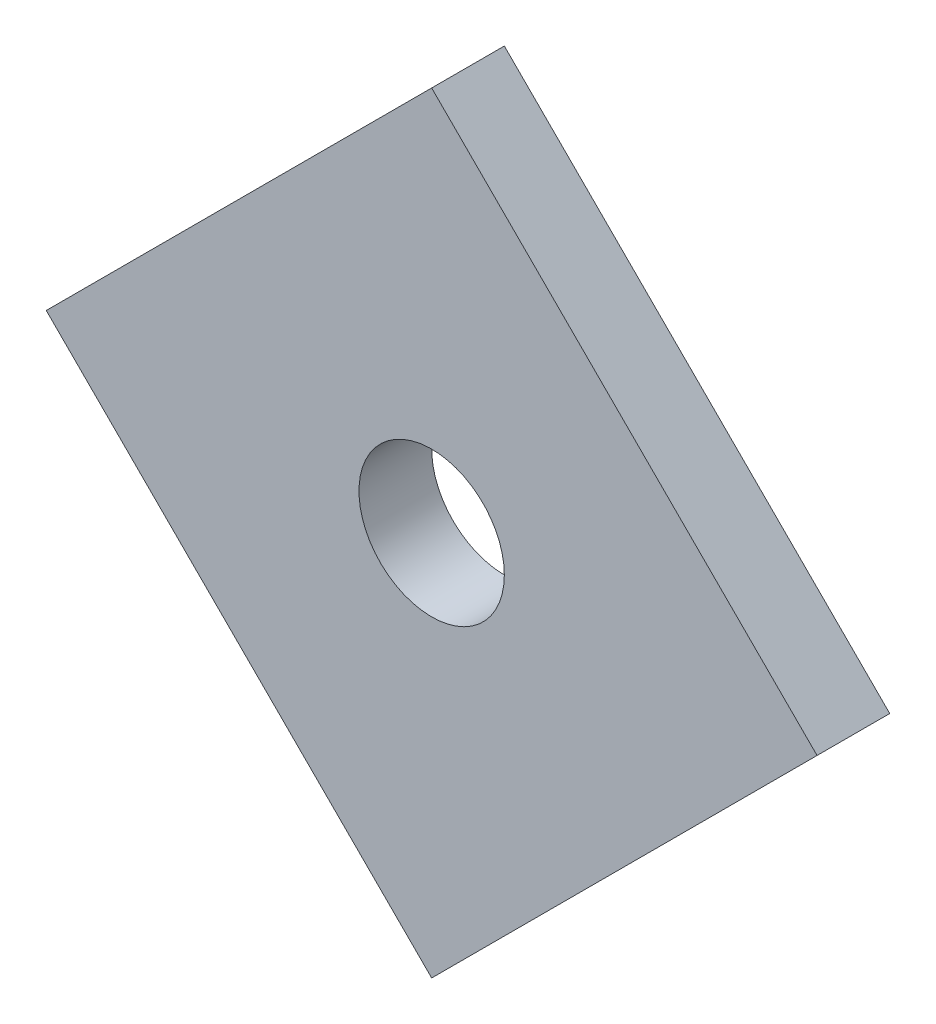
from build123d import *

# Parameters (mm, degrees)
CROQUIS1_R              = 10
SALIENTE_EXTRUIR1_DEPTH = 10


with BuildPart() as part:
    # Croquis1 → Saliente-Extruir1 (new body)
    with BuildSketch(Plane.XY):
        Polygon((-53.033008589, 0), (0, 53.033008589), (53.033008589, 0), (0, -53.033008589), align=None)
        Circle(CROQUIS1_R, mode=Mode.SUBTRACT)
    extrude(amount=SALIENTE_EXTRUIR1_DEPTH)


solid = part.part
